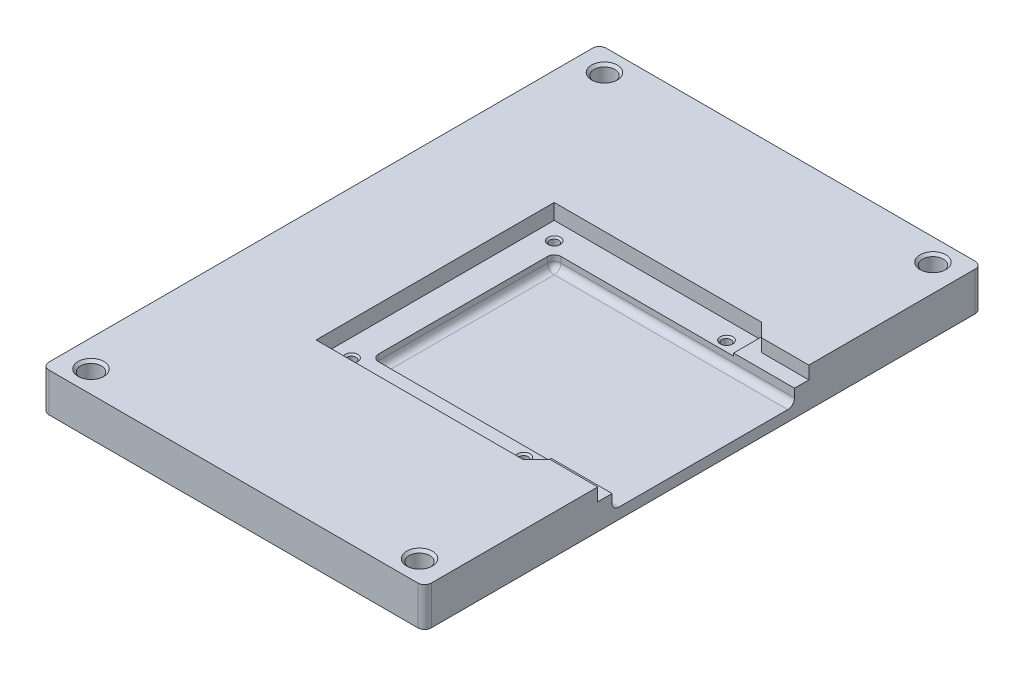
from build123d import *

# Parameters (mm, degrees)
BOSS_EXTRUDE1_DEPTH     = 11.5
SKETCH4_R               = 3.075
CUT_EXTRUDE1_DEPTH      = 6
CUT_EXTRUDE6_DEPTH      = 4.6
CUT_EXTRUDE3_DEPTH      = 101.30080072
CUT_EXTRUDE3_DEPTH_BACK = 3.7
SKETCH24_W              = 71.125
SKETCH24_H              = 54
SKETCH25_R              = 1.35
CUT_EXTRUDE4_DEPTH      = 5
CHAMFER4_SIZE           = 0.5
FILLET1_R               = 2
BOSS_EXTRUDE2_DEPTH     = 0.8
CHAMFER5_SIZE           = 0.75


with BuildPart() as part:
    # Sketch1 → Boss-Extrude1 (new body)
    with BuildSketch(Plane(origin=(0, 0, 0), x_dir=(1, 0, 0), z_dir=(0, 1, 0))):
        with BuildLine():
            Line((-56.625, 67.5), (-56.625, -67.5))
            Line((-56.625, -67.5), (-56.625, -80.5))
            ThreePointArc((-56.625, -80.5), (-56.039213562, -81.914213562), (-54.625, -82.5))
            Line((-54.625, -82.5), (54.625, -82.5))
            ThreePointArc((54.625, -82.5), (56.039213562, -81.914213562), (56.625, -80.5))
            Line((56.625, -80.5), (56.625, -67.5))
            Line((56.625, -67.5), (56.625, 67.5))
            Line((56.625, 67.5), (56.625, 80.5))
            ThreePointArc((56.625, 80.5), (56.039213562, 81.914213562), (54.625, 82.5))
            Line((54.625, 82.5), (-54.625, 82.5))
            ThreePointArc((-54.625, 82.5), (-56.039213562, 81.914213562), (-56.625, 80.5))
            Line((-56.625, 80.5), (-56.625, 67.5))
        make_face()
    extrude(amount=BOSS_EXTRUDE1_DEPTH)

    # Sketch4 → Cut-Extrude1 (cut)
    with BuildSketch(Plane(origin=(0, 11.5, 0), x_dir=(1, 0, 0), z_dir=(0, 1, 0))):
        with Locations(Location((-48.625, -76, 0), (0, 0, 270))):
            Circle(SKETCH4_R)
        with Locations(Location((48.625, -76, 0), (0, 0, 270))):
            Circle(SKETCH4_R)
        with Locations(Location((48.625, 76, 0), (0, 0, 270))):
            Circle(SKETCH4_R)
        with Locations(Location((-48.625, 76, 0), (0, 0, 270))):
            Circle(SKETCH4_R)
    extrude(amount=-CUT_EXTRUDE1_DEPTH, mode=Mode.SUBTRACT)

    # Sketch21 → Cut-Extrude6 (cut)
    with BuildSketch(Plane(origin=(0, 11.5, 0), x_dir=(1, 0, 0), z_dir=(0, 1, 0))):
        Polygon((56.625, 31), (56.625, -31), (56.625, -31.25), (42.603553391, -31.25), (38.603553391, -35.25), (-22.75, -35.25), (-22.75, 35.25), (38.603553391, 35.25), (42.603553391, 31.25), (56.625, 31.25), align=None)
    extrude(amount=-CUT_EXTRUDE6_DEPTH, mode=Mode.SUBTRACT)

    # Sketch24 → Cut-Extrude3 (cut, two sides: drawn at the far end of the back side and taken through both)
    with BuildSketch(Plane(origin=(0, 6.9, 0), x_dir=(1, 0, 0), z_dir=(0, 1, 0)).offset(-CUT_EXTRUDE3_DEPTH_BACK)):
        with Locations((21.0625, 0)):
            Rectangle(SKETCH24_W, SKETCH24_H)
    extrude(amount=CUT_EXTRUDE3_DEPTH + CUT_EXTRUDE3_DEPTH_BACK, mode=Mode.SUBTRACT)

    # Sketch25 → Cut-Extrude4 (cut)
    with BuildSketch(Plane(origin=(0, 6.9, 0), x_dir=(1, 0, 0), z_dir=(0, 1, 0))):
        with Locations(Location((33.5, 30, 0), (0, 0, 270))):
            Circle(SKETCH25_R)
        with Locations(Location((-17.5, 30, 0), (0, 0, 270))):
            Circle(SKETCH25_R)
        with Locations(Location((33.5, -30, 0), (0, 0, 270))):
            Circle(SKETCH25_R)
        with Locations(Location((-17.5, -30, 0), (0, 0, 270))):
            Circle(SKETCH25_R)
    extrude(amount=-CUT_EXTRUDE4_DEPTH, mode=Mode.SUBTRACT)

    # Chamfer4
    chamfer4_edges = [part.edges().sort_by_distance(p)[0] for p in [
        (-17.5, 6.9, -31.35),
        (33.5, 6.9, 28.65),
        (-17.5, 6.9, 28.65),
        (33.5, 6.9, -31.35),
    ]]
    chamfer(chamfer4_edges, length=CHAMFER4_SIZE)

    # Fillet1
    fillet1_edges = [part.edges().sort_by_distance(p)[0] for p in [
        (21.0625, 3.2, -27),
        (-14.5, 5.05, -27),
        (-14.5, 3.2, 0),
        (-14.5, 5.05, 27),
        (21.0625, 3.2, 27),
    ]]
    fillet(fillet1_edges, radius=FILLET1_R)

    # Sketch26 → Boss-Extrude2 (add)
    with BuildSketch(Plane(origin=(0, 6.9, 0), x_dir=(1, 0, 0), z_dir=(0, 1, 0))):
        Polygon((38.603553391, 35.25), (38.603553391, 27), (56.625, 27), (56.625, 31.25), (42.603553391, 31.25), align=None)
        Polygon((42.603553391, -31.25), (38.603553391, -35.25), (38.603553391, -27), (56.625, -27), (56.625, -31.25), align=None)
    extrude(amount=BOSS_EXTRUDE2_DEPTH)

    # Chamfer5
    chamfer5_edges = [part.edges().sort_by_distance(p)[0] for p in [
        (-48.625, 11.5, -79.075),
        (48.625, 11.5, -79.075),
        (48.625, 11.5, 72.925),
        (-48.625, 11.5, 72.925),
    ]]
    chamfer(chamfer5_edges, length=CHAMFER5_SIZE)


solid = part.part
